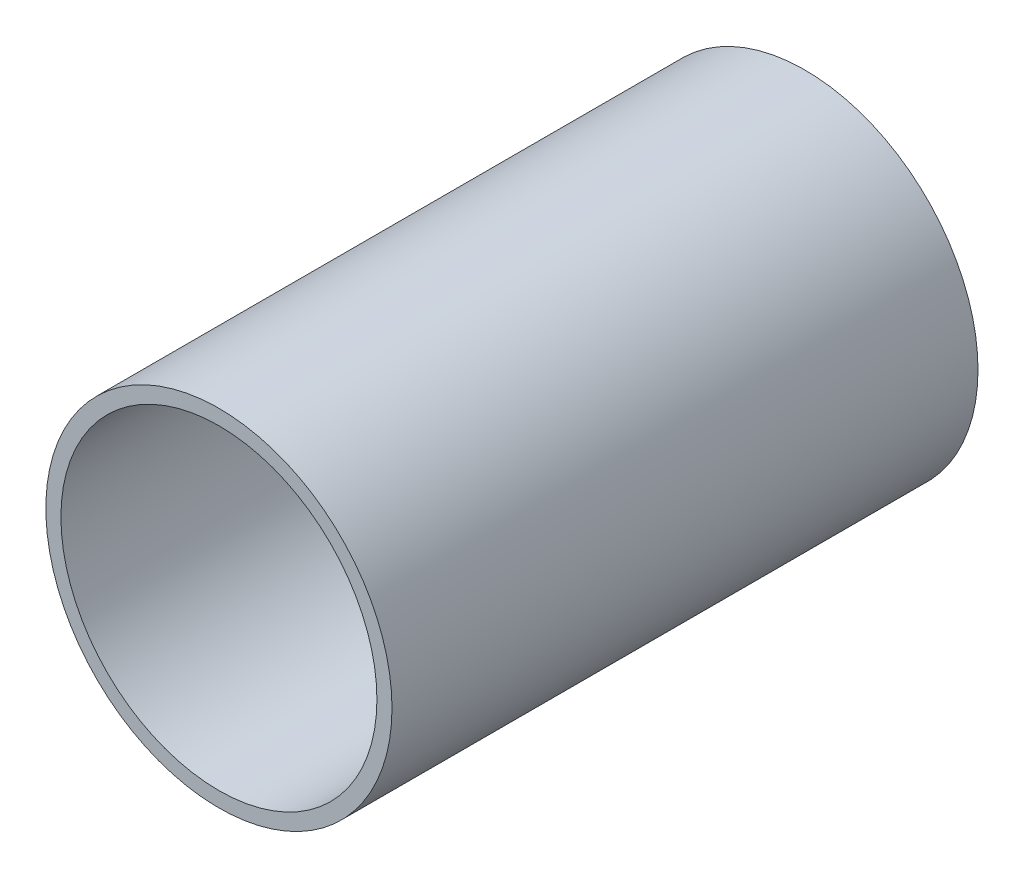
from build123d import *

# Parameters (mm, degrees)
SKETCH1_R           = 11.666
SKETCH1_R_2         = 10.65
BOSS_EXTRUDE1_DEPTH = 39.5


with BuildPart() as part:
    # Sketch1 → Boss-Extrude1 (new body)
    with BuildSketch(Plane(origin=(0, 0, 0), x_dir=(0.9998860245595665, 0.015097612078275651, 0), z_dir=(0, 0, 1))):
        with Locations(Location((-53.912398563, 33.159274187, 0), (0, 0, 359.134937682))):
            Circle(SKETCH1_R)
        with Locations(Location((-53.912398563, 33.159274187, 0), (0, 0, 359.134937682))):
            Circle(SKETCH1_R_2, mode=Mode.SUBTRACT)
    extrude(amount=BOSS_EXTRUDE1_DEPTH)


solid = part.part
